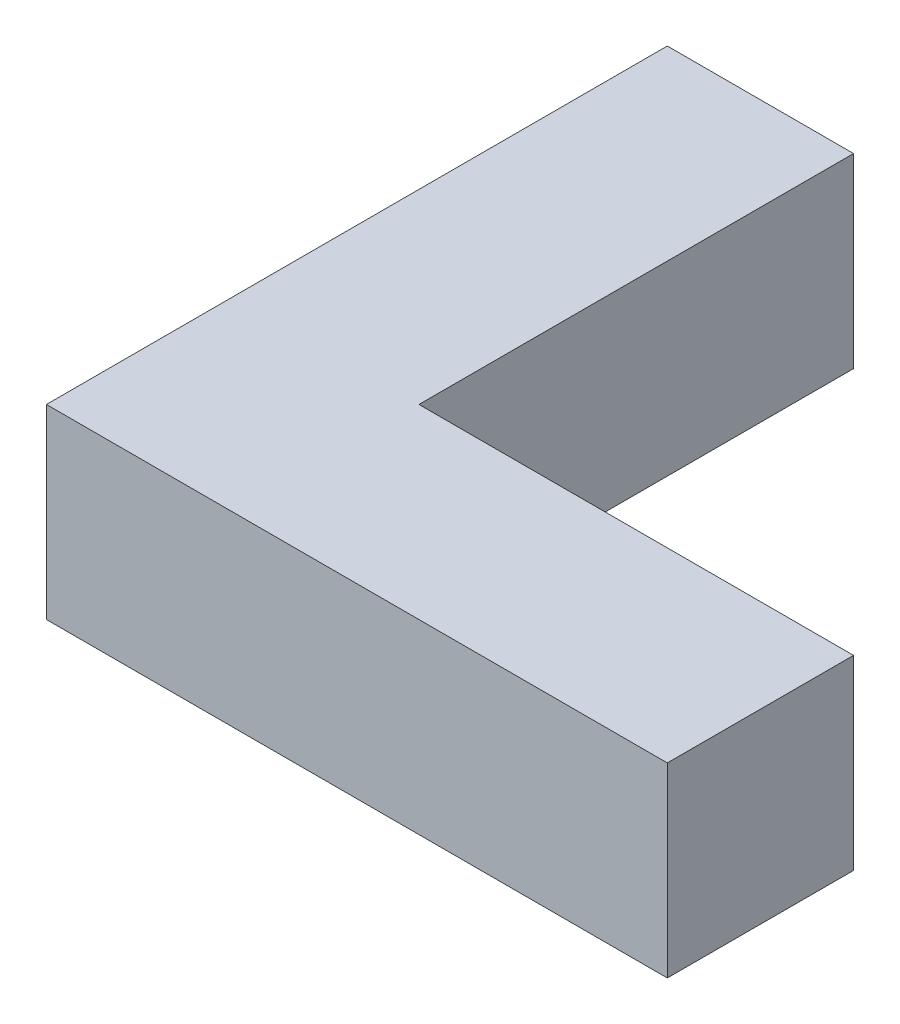
from build123d import *

# Parameters (mm, degrees)
BOSS_EXTRUDE1_DEPTH = 3


with BuildPart() as part:
    # Sketch1 → Boss-Extrude1 (new body)
    with BuildSketch(Plane(origin=(0, 0, 0), x_dir=(1, 0, 0), z_dir=(0, 1, 0))):
        Polygon((0, 0), (0, 10), (3, 10), (3, 3), (10, 3), (10, 0), align=None)
    extrude(amount=BOSS_EXTRUDE1_DEPTH)


solid = part.part
